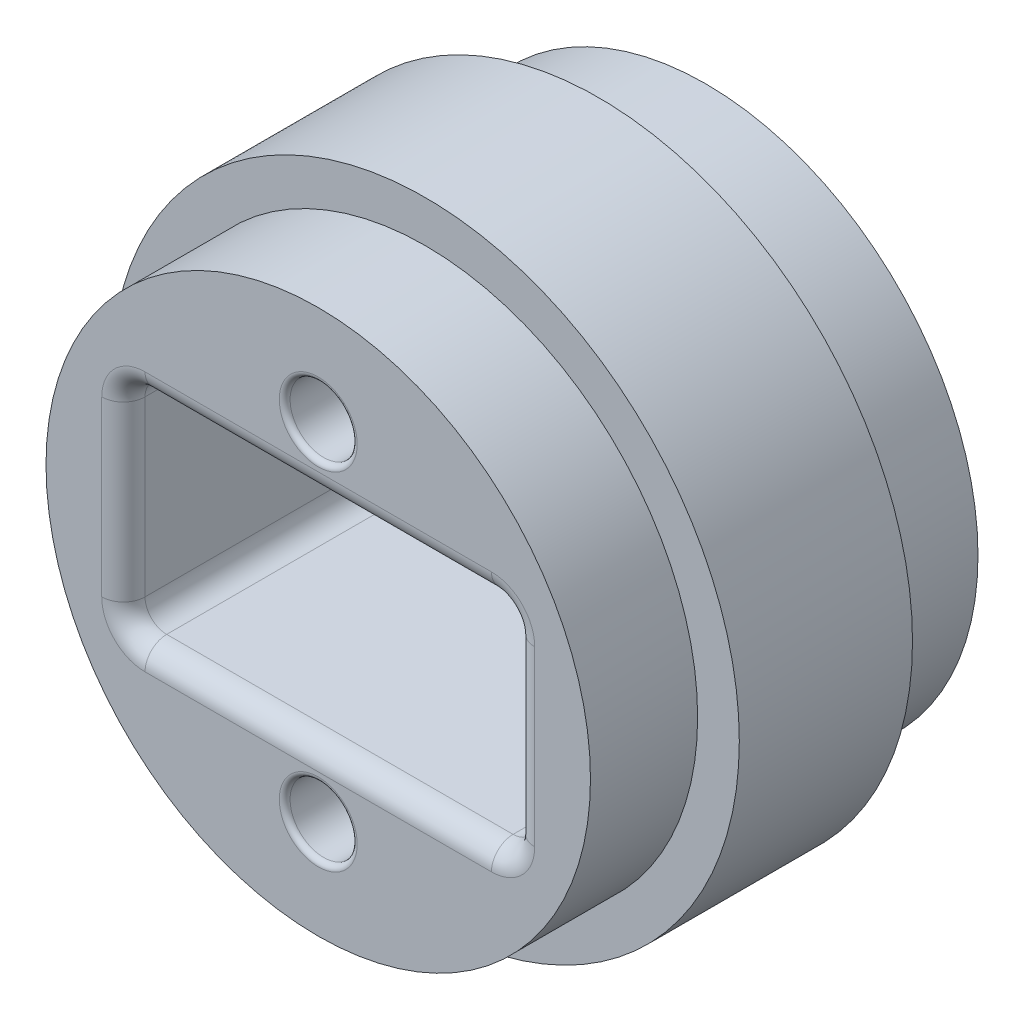
from build123d import *

# Parameters (mm, degrees)
ESQUISSE1_R             = 14.5
BOSS_EXTRU_1_DEPTH      = 8
BOSS_EXTRU_2_DEPTH      = 4.95
BOSS_EXTRU_2_DEPTH_BACK = 12.95
ESQUISSE2_R             = 12.575
ESQUISSE3_R             = 1.55
ENL_V_MAT_EXTRU_1_DEPTH = 28.219662011
CONG_1_R                = 1
CONG_2_R                = 0.25


with BuildPart() as part:
    # Esquisse1 → Boss.-Extru.1 (new body)
    with BuildSketch(Plane.XY):
        Circle(ESQUISSE1_R)
    extrude(amount=BOSS_EXTRU_1_DEPTH)

    # Esquisse2 → Boss.-Extru.2 (add, two sides: drawn at the far end of the back side and taken through both)
    with BuildSketch(Plane.XY.offset(8).offset(-BOSS_EXTRU_2_DEPTH_BACK)):
        Circle(ESQUISSE2_R)
    extrude(amount=BOSS_EXTRU_2_DEPTH + BOSS_EXTRU_2_DEPTH_BACK)

    # Esquisse3 → Enlèv. mat.-Extru.1 (cut, through all)
    with BuildSketch(Plane.XY.offset(12.95)):
        with Locations((0, 8)):
            Circle(ESQUISSE3_R)
        with Locations((0, -8)):
            Circle(ESQUISSE3_R)
        with BuildLine():
            Line((-8, -5), (8, -5))
            ThreePointArc((8, -5), (8.707106781, -4.707106781), (9, -4))
            Line((9, -4), (9, 4))
            ThreePointArc((9, 4), (8.707106781, 4.707106781), (8, 5))
            Line((8, 5), (-8, 5))
            ThreePointArc((-8, 5), (-8.707106781, 4.707106781), (-9, 4))
            Line((-9, 4), (-9, -4))
            ThreePointArc((-9, -4), (-8.707106781, -4.707106781), (-8, -5))
        make_face()
    extrude(amount=-ENL_V_MAT_EXTRU_1_DEPTH, mode=Mode.SUBTRACT)

    # Congé1
    cong_1_edges = [part.edges().sort_by_distance(p)[0] for p in [
        (8.707106781, 4.707106781, -4.95),
        (9, 0, -4.95),
        (8.707106781, -4.707106781, -4.95),
        (0, -5, -4.95),
        (-8.707106781, -4.707106781, -4.95),
        (-9, 0, -4.95),
        (-8.707106781, 4.707106781, -4.95),
        (0, 5, -4.95),
        (8.707106781, 4.707106781, 12.95),
        (0, 5, 12.95),
        (-8.707106781, 4.707106781, 12.95),
        (-9, 0, 12.95),
        (-8.707106781, -4.707106781, 12.95),
        (0, -5, 12.95),
        (8.707106781, -4.707106781, 12.95),
        (9, 0, 12.95),
    ]]
    fillet(cong_1_edges, radius=CONG_1_R)

    # Congé2
    cong_2_edges = [part.edges().sort_by_distance(p)[0] for p in [
        (-1.55, -8, -4.95),
        (-1.55, -8, 12.95),
        (-1.55, 8, -4.95),
        (-1.55, 8, 12.95),
    ]]
    fillet(cong_2_edges, radius=CONG_2_R)


solid = part.part
